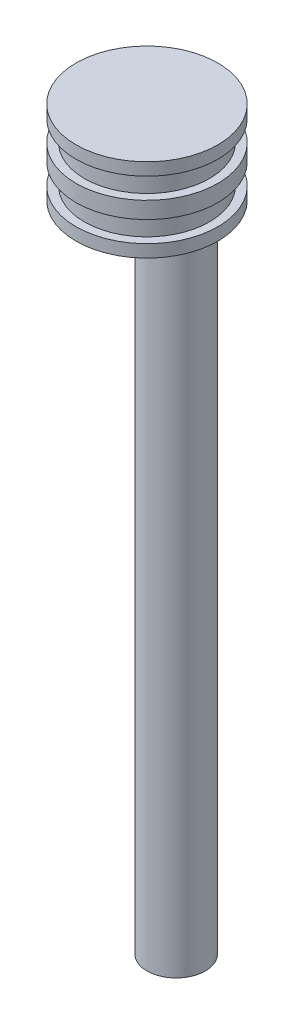
from build123d import *

# Parameters (mm, degrees)
SKETCH2_R           = 8.5
BOSS_EXTRUDE1_DEPTH = 10
CUT_EXTRUDE1_START  = 1.5
SKETCH2_2_R         = 8.5
CUT_EXTRUDE1_DEPTH  = 2.5
CUT_EXTRUDE2_START  = 6
SKETCH2_3_R         = 8.5
CUT_EXTRUDE2_DEPTH  = 2.5
SKETCH4_R           = 7.5
BOSS_EXTRUDE3_DEPTH = 9
SKETCH5_R           = 3.5
BOSS_EXTRUDE4_DEPTH = 80


with BuildPart() as part:
    # Sketch2 → Boss-Extrude1 (new body)
    with BuildSketch(Plane(origin=(0, 0, 0), x_dir=(1, 0, 0), z_dir=(0, 1, 0))):
        with Locations(Location((0, 0, 0), (0, 0, 270))):
            Circle(SKETCH2_R)
    extrude(amount=BOSS_EXTRUDE1_DEPTH)

    # Sketch2<2> → Cut-Extrude1 (cut)
    with BuildSketch(Plane(origin=(0, 0, 0), x_dir=(1, 0, 0), z_dir=(0, 1, 0)).offset(CUT_EXTRUDE1_START)):
        with Locations(Location((0, 0, 0), (0, 0, 270))):
            Circle(SKETCH2_2_R)
    extrude(amount=CUT_EXTRUDE1_DEPTH, mode=Mode.SUBTRACT)


with BuildPart() as cut_extrude1_piece_1:
    # of the separate pieces the step leaves, piece 1, a body of its own (cut_extrude1_pieces)
    add(part.part.solids().sort_by_distance((0, 4, 8.5))[0])

    # Sketch2<3> → Cut-Extrude2 (cut)
    with BuildSketch(Plane(origin=(0, 0, 0), x_dir=(1, 0, 0), z_dir=(0, 1, 0)).offset(CUT_EXTRUDE2_START)):
        with Locations(Location((0, 0, 0), (0, 0, 270))):
            Circle(SKETCH2_3_R)
    extrude(amount=CUT_EXTRUDE2_DEPTH, mode=Mode.SUBTRACT)


with BuildPart() as cut_extrude1_piece_2:
    # of the separate pieces the step leaves, piece 2, a body of its own (cut_extrude1_pieces)
    add(part.part.solids().sort_by_distance((0, 0, 8.5))[0])

    # Sketch4 → Boss-Extrude3 (add)
    with BuildSketch(Plane(origin=(0, 0, 0), x_dir=(1, 0, 0), z_dir=(0, 1, 0))):
        with Locations(Location((0, 0, 0), (0, 0, 270))):
            Circle(SKETCH4_R)
    extrude(amount=BOSS_EXTRUDE3_DEPTH)

    # Sketch5 → Boss-Extrude4 (add)
    with BuildSketch(Plane.XZ):
        with Locations(Location((0, -3.5, 0), (0, 0, 270))):
            Circle(SKETCH5_R)
    extrude(amount=BOSS_EXTRUDE4_DEPTH)


with BuildPart() as cut_extrude2_piece_1:
    # of the separate pieces the step leaves, piece 1, a body of its own (cut_extrude2_pieces)
    add(cut_extrude1_piece_1.part.solids().sort_by_distance((0, 4, 8.5))[0])


with BuildPart() as cut_extrude2_piece_2:
    # of the separate pieces the step leaves, piece 2, a body of its own (cut_extrude2_pieces)
    add(cut_extrude1_piece_1.part.solids().sort_by_distance((0, 8.5, 8.5))[0])


solid = Compound([cut_extrude1_piece_2.part, cut_extrude2_piece_1.part, cut_extrude2_piece_2.part])
